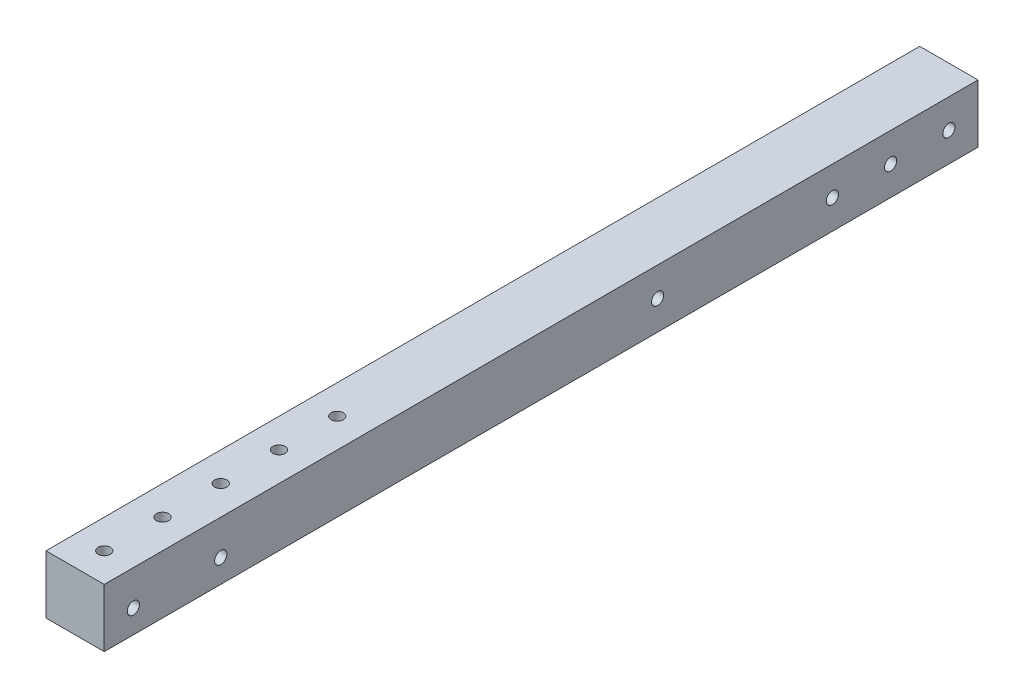
from build123d import *

# Parameters (mm, degrees)
SKETCH_1_W          = 20
SKETCH_1_H          = 20
EXTRUDE_1_DEPTH     = 300
SKETCH_3_R          = 2.1
CUT_EXTRUDE_1_DEPTH = 301.83217913
SKETCH_4_R          = 2.1
CUT_EXTRUDE_2_DEPTH = 301.83217913
SKETCH_5_R          = 2.1
CUT_EXTRUDE_3_DEPTH = 301.83217913
SKETCH_7_R          = 2.1
CUT_EXTRUDE_4_DEPTH = 301.83217913
SKETCH_8_R          = 2.1
CUT_EXTRUDE_5_DEPTH = 301.83217913


with BuildPart() as part:
    # 草图1 → 凸台-拉伸1 (new body)
    with BuildSketch(Plane.XY):
        Rectangle(SKETCH_1_W, SKETCH_1_H)
    extrude(amount=EXTRUDE_1_DEPTH)

    # 草图3 → 切除-拉伸1 (cut, through all)
    with BuildSketch(Plane(origin=(10, 0, 0), x_dir=(0, 0, -1), z_dir=(1, 0, 0))):
        with Locations((-10, 0)):
            Circle(SKETCH_3_R)
        with Locations((-30, 0)):
            Circle(SKETCH_3_R)
    extrude(amount=-CUT_EXTRUDE_1_DEPTH, mode=Mode.SUBTRACT)

    # 草图4 → 切除-拉伸2 (cut, through all)
    with BuildSketch(Plane(origin=(10, 0, 0), x_dir=(0, 0, -1), z_dir=(1, 0, 0))):
        with Locations((-110, 0)):
            Circle(SKETCH_4_R)
    extrude(amount=-CUT_EXTRUDE_2_DEPTH, mode=Mode.SUBTRACT)

    # 草图5 → 切除-拉伸3 (cut, through all)
    with BuildSketch(Plane(origin=(10, 0, 0), x_dir=(0, 0, -1), z_dir=(1, 0, 0))):
        with Locations((-50, 0)):
            Circle(SKETCH_5_R)
    extrude(amount=-CUT_EXTRUDE_3_DEPTH, mode=Mode.SUBTRACT)

    # 草图7 → 切除-拉伸4 (cut, through all)
    with BuildSketch(Plane.XZ.offset(10)):
        with Locations(Location((0, 290, 0), (0, 0, 270))):
            Circle(SKETCH_7_R)
        with Locations(Location((0, 270, 0), (0, 0, 270))):
            Circle(SKETCH_7_R)
        with Locations(Location((0, 250, 0), (0, 0, 270))):
            Circle(SKETCH_7_R)
        with Locations(Location((0, 230, 0), (0, 0, 270))):
            Circle(SKETCH_7_R)
        with Locations(Location((0, 210, 0), (0, 0, 270))):
            Circle(SKETCH_7_R)
    extrude(amount=-CUT_EXTRUDE_4_DEPTH, mode=Mode.SUBTRACT)

    # 草图8 → 切除-拉伸5 (cut, through all)
    with BuildSketch(Plane(origin=(10, 0, 0), x_dir=(0, 0, -1), z_dir=(1, 0, 0))):
        with Locations((-290, -2)):
            Circle(SKETCH_8_R)
        with Locations((-260, -2)):
            Circle(SKETCH_8_R)
    extrude(amount=-CUT_EXTRUDE_5_DEPTH, mode=Mode.SUBTRACT)


solid = part.part
